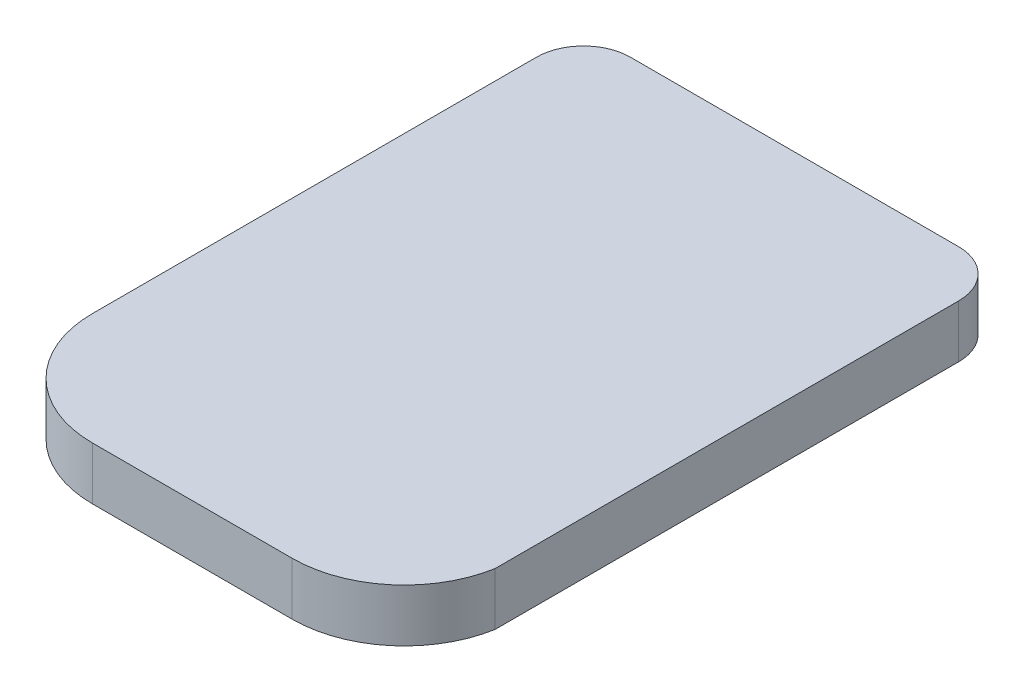
from build123d import *

# Parameters (mm, degrees)
BOSS_EXTRUDE6_DEPTH = 10


with BuildPart() as part:
    # Sketch5 → Boss-Extrude6 (new body)
    with BuildSketch(Plane(origin=(0, 0, 0), x_dir=(1, 0, 0), z_dir=(0, 1, 0))):
        with BuildLine():
            Line((-41.302076053, 46.911975672), (-41.302076053, -37.26221373))
            ThreePointArc((-41.302076053, -37.26221373), (-35.082251132, -52.278199408), (-20.066265455, -58.498024328))
            Line((-20.066265455, -58.498024328), (17.796954386, -58.498024328))
            ThreePointArc((17.796954386, -58.498024328), (31.442178314, -53.533892062), (38.707923947, -40.962349372))
            Line((38.707923947, -40.962349372), (38.707923947, 46.911975672))
            ThreePointArc((38.707923947, 46.911975672), (36.104103232, 53.198154956), (29.817923947, 55.801975672))
            Line((29.817923947, 55.801975672), (-32.412076053, 55.801975672))
            ThreePointArc((-32.412076053, 55.801975672), (-38.698255337, 53.198154956), (-41.302076053, 46.911975672))
        make_face()
    extrude(amount=BOSS_EXTRUDE6_DEPTH)


solid = part.part
